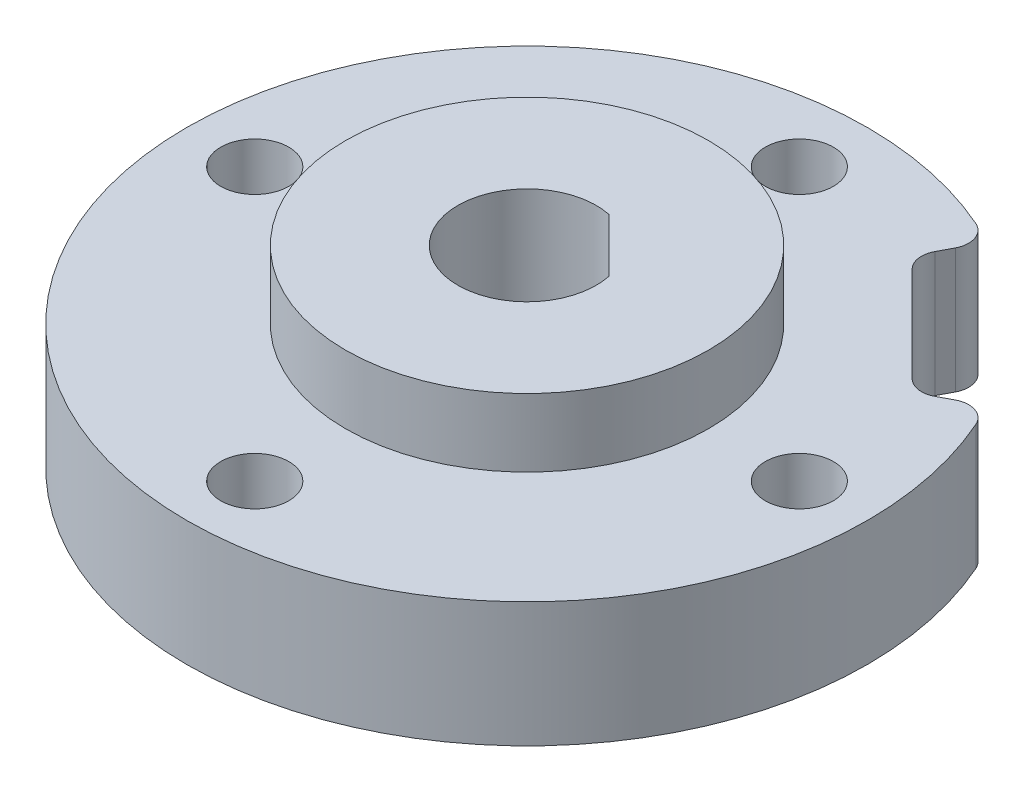
from build123d import *

# Parameters (mm, degrees)
SKETCH_1_R               = 15
SKETCH_1_R_2             = 2
SKETCH_1_R_3             = 1.5
EXTRUDE_1_DEPTH          = 3
EXTRUDE_2_DEPTH          = 4.25
EXTRUDE_2_DEPTH_BACK     = 7.25
SKETCH_2_R               = 8
EXTRUDE_3_DEPTH          = 1.25
EXTRUDE_3_DEPTH_BACK     = 4.25
SKETCH_5_R               = 15
CUT_EXTRUDE_1_DEPTH      = 5
CUT_EXTRUDE_1_DEPTH_BACK = 16.5
SKETCH_6_R               = 1.3
CUT_EXTRUDE_2_DEPTH      = 14
SKETCH_7_R               = 1.5
CUT_EXTRUDE_4_DEPTH      = 14
CUT_EXTRUDE_START        = -14
CUT_EXTRUDE_5_DEPTH      = 14
FILLET_1_R               = 1


with BuildPart() as part:
    # 草图1 → 凸台-拉伸1 (new body)
    with BuildSketch(Plane(origin=(0, 0, 0), x_dir=(1, 0, 0), z_dir=(0, 1, 0))):
        with Locations(Location((0, 0, 0), (0, 0, 270))):
            Circle(SKETCH_1_R)
        with Locations(Location((0, 0, 0), (0, 0, 270))):
            Circle(SKETCH_1_R_2, mode=Mode.SUBTRACT)
        with Locations(Location((0, 6, 0), (0, 0, 270))):
            Circle(SKETCH_1_R_3, mode=Mode.SUBTRACT)
        with Locations(Location((6, 0, 0), (0, 0, 270))):
            Circle(SKETCH_1_R_3, mode=Mode.SUBTRACT)
        with Locations(Location((0, -6, 0), (0, 0, 270))):
            Circle(SKETCH_1_R_3, mode=Mode.SUBTRACT)
        with Locations(Location((-6, 0, 0), (0, 0, 270))):
            Circle(SKETCH_1_R_3, mode=Mode.SUBTRACT)
        with Locations(Location((0, 12, 0), (0, 0, 270))):
            Circle(SKETCH_1_R_3, mode=Mode.SUBTRACT)
        with Locations(Location((12, 0, 0), (0, 0, 270))):
            Circle(SKETCH_1_R_3, mode=Mode.SUBTRACT)
        with Locations(Location((0, -12, 0), (0, 0, 270))):
            Circle(SKETCH_1_R_3, mode=Mode.SUBTRACT)
        with Locations(Location((-12, 0, 0), (0, 0, 270))):
            Circle(SKETCH_1_R_3, mode=Mode.SUBTRACT)
    extrude(amount=EXTRUDE_1_DEPTH)

    # 草图2 → 凸台-拉伸2 (add, two sides: drawn at the far end of the back side and taken through both)
    with BuildSketch(Plane.XZ.offset(-EXTRUDE_2_DEPTH_BACK)):
        with Locations(Location((0, 0, 0), (0, 0, 270))):
            Circle(SKETCH_2_R)
    extrude(amount=EXTRUDE_2_DEPTH + EXTRUDE_2_DEPTH_BACK)

    # 草图5 → 凸台-拉伸3 (add, two sides: drawn at the far end of the back side and taken through both)
    with BuildSketch(Plane(origin=(0, 3, 0), x_dir=(1, 0, 0), z_dir=(0, 1, 0)).offset(-EXTRUDE_3_DEPTH_BACK)):
        with Locations(Location((0, 0, 0), (0, 0, 270))):
            Circle(SKETCH_5_R)
    extrude(amount=EXTRUDE_3_DEPTH + EXTRUDE_3_DEPTH_BACK)

    # 草图3 → 切除-拉伸1 (cut, two sides: drawn at the far end of the back side and taken through both)
    with BuildSketch(Plane(origin=(0, 3, 0), x_dir=(1, 0, 0), z_dir=(0, 1, 0)).offset(-CUT_EXTRUDE_1_DEPTH_BACK)):
        with BuildLine():
            Line((0.619906335, 2.986338249), (2.986338249, 0.619906335))
            ThreePointArc((2.986338249, 0.619906335), (-2.156675683, -2.156675683), (0.619906335, 2.986338249))
        make_face()
    extrude(amount=CUT_EXTRUDE_1_DEPTH + CUT_EXTRUDE_1_DEPTH_BACK, mode=Mode.SUBTRACT)

    # 草图6 → 切除-拉伸2 (cut)
    with BuildSketch(Plane(origin=(1.803122292, 0, -1.803122292), x_dir=(0.7071067811865465, 0, 0.7071067811865486), z_dir=(-0.7071067811865486, 0, 0.7071067811865465))):
        with Locations((0, 1.5)):
            Circle(SKETCH_6_R)
    extrude(amount=-CUT_EXTRUDE_2_DEPTH, mode=Mode.SUBTRACT)

    # 草图7 → 切除-拉伸4 (cut)
    with BuildSketch(Plane(origin=(0, 7.25, 0), x_dir=(1, 0, 0), z_dir=(0, 1, 0))):
        with Locations(Location((0, 12, 0), (0, 0, 270))):
            Circle(SKETCH_7_R)
        with Locations(Location((-12, 0, 0), (0, 0, 270))):
            Circle(SKETCH_7_R)
        with Locations(Location((12, 0, 0), (0, 0, 270))):
            Circle(SKETCH_7_R)
        with Locations(Location((0, -12, 0), (0, 0, 270))):
            Circle(SKETCH_7_R)
    extrude(amount=-CUT_EXTRUDE_4_DEPTH, mode=Mode.SUBTRACT)

    # 草图8 → 切除-拉伸5 (cut)
    with BuildSketch(Plane(origin=(0, 4.25, 0), x_dir=(1, 0, 0), z_dir=(0, 1, 0)).offset(CUT_EXTRUDE_START)):
        with BuildLine():
            Line((7.02021556, 13.255812819), (5.875756654, 11.094806094))
            Line((5.875756654, 11.094806094), (11.094806094, 5.875756654))
            Line((11.094806094, 5.875756654), (13.255812819, 7.02021556))
            ThreePointArc((13.255812819, 7.02021556), (10.606601718, 10.606601718), (7.02021556, 13.255812819))
        make_face()
    extrude(amount=CUT_EXTRUDE_5_DEPTH, mode=Mode.SUBTRACT)

    # 圆角1
    fillet_1_edges = [part.edges().sort_by_distance(p)[0] for p in [
        (13.255812819, 1.5, -7.02021556),
        (5.875756654, 1.5, -11.094806094),
        (7.02021556, 1.5, -13.255812819),
        (11.094806094, 1.5, -5.875756654),
    ]]
    fillet(fillet_1_edges, radius=FILLET_1_R)


solid = part.part
